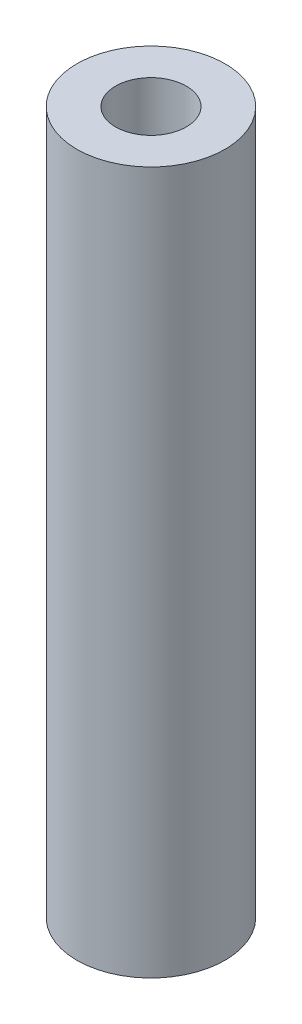
from build123d import *

# Parameters (mm, degrees)
SKETCH1_R           = 4.5
SKETCH1_R_2         = 2.15
BOSS_EXTRUDE1_DEPTH = 21.325


with BuildPart() as part:
    # Sketch1 → Boss-Extrude1 (new, symmetric)
    with BuildSketch(Plane(origin=(0, 0, 0), x_dir=(1, 0, 0), z_dir=(0, 1, 0))):
        with Locations(Location((0, 0, 0), (0, 0, 270))):
            Circle(SKETCH1_R)
        with Locations(Location((0, 0, 0), (0, 0, 270))):
            Circle(SKETCH1_R_2, mode=Mode.SUBTRACT)
    extrude(amount=BOSS_EXTRUDE1_DEPTH, both=True)


solid = part.part
